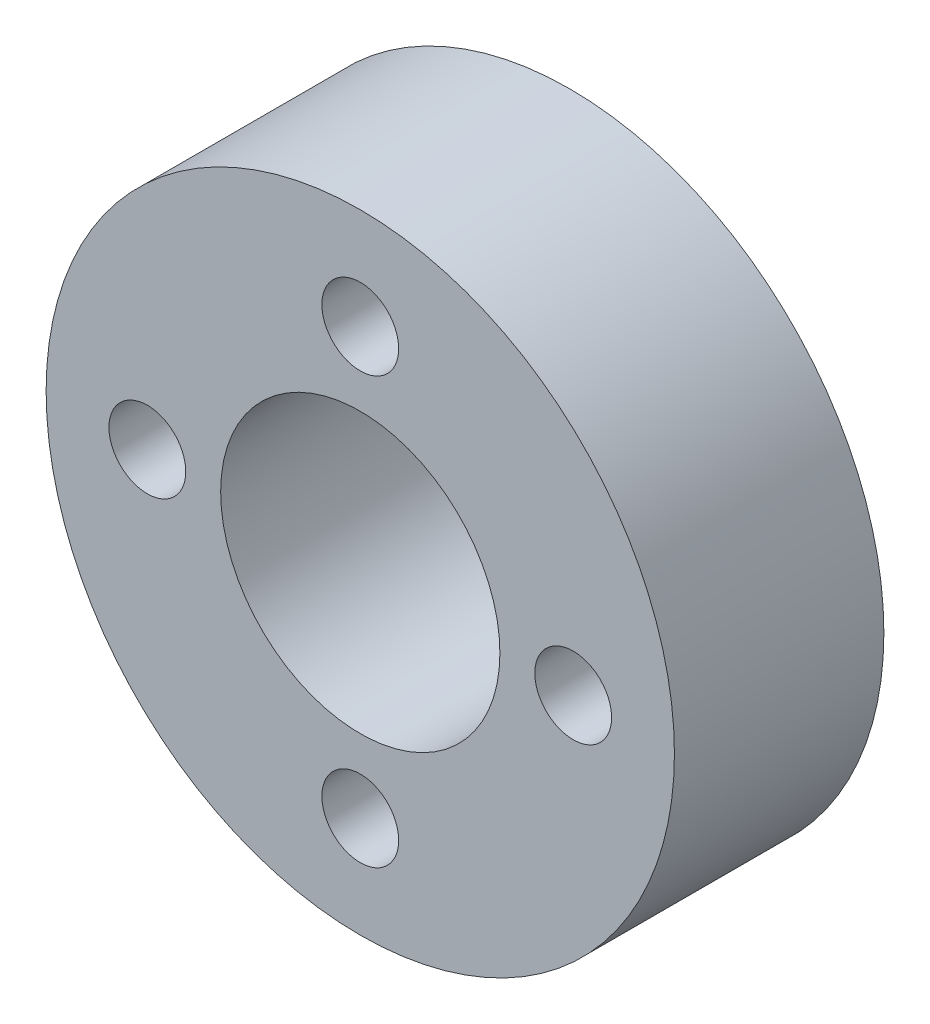
from build123d import *

# Parameters (mm, degrees)
SKIZZE1_R                       = 22.5
AUFSATZ_LINEAR_AUSTRAGEN1_DEPTH = 15
SKIZZE2_R                       = 16
AUFSATZ_LINEAR_AUSTRAGEN2_DEPTH = 2
SKIZZE3_R                       = 10
SCHNITT_LINEAR_AUSTRAGEN1_DEPTH = 37.076308015
SKIZZE7_R                       = 2.75
SCHNITT_LINEAR_AUSTRAGEN2_DEPTH = 37.076308015


with BuildPart() as part:
    # Skizze1 → Aufsatz-Linear austragen1 (new body)
    with BuildSketch(Plane.XY):
        Circle(SKIZZE1_R)
    extrude(amount=AUFSATZ_LINEAR_AUSTRAGEN1_DEPTH)

    # Skizze2 → Aufsatz-Linear austragen2 (add)
    with BuildSketch(Plane(origin=(0, 0, 0), x_dir=(-1, 0, 0), z_dir=(0, 0, -1))):
        Circle(SKIZZE2_R)
    extrude(amount=AUFSATZ_LINEAR_AUSTRAGEN2_DEPTH)

    # Skizze3 → Schnitt-Linear austragen1 (cut, through all)
    with BuildSketch(Plane(origin=(0, 0, -2), x_dir=(-1, 0, 0), z_dir=(0, 0, -1))):
        Circle(SKIZZE3_R)
    extrude(amount=-SCHNITT_LINEAR_AUSTRAGEN1_DEPTH, mode=Mode.SUBTRACT)

    # Skizze7 → Schnitt-Linear austragen2 (cut, through all)
    with BuildSketch(Plane(origin=(0, 0, -2), x_dir=(-1, 0, 0), z_dir=(0, 0, -1))):
        with Locations((0, 15.25)):
            Circle(SKIZZE7_R)
        with Locations((15.25, 0)):
            Circle(SKIZZE7_R)
        with Locations((0, -15.25)):
            Circle(SKIZZE7_R)
        with Locations((-15.25, 0)):
            Circle(SKIZZE7_R)
    extrude(amount=-SCHNITT_LINEAR_AUSTRAGEN2_DEPTH, mode=Mode.SUBTRACT)


solid = part.part
